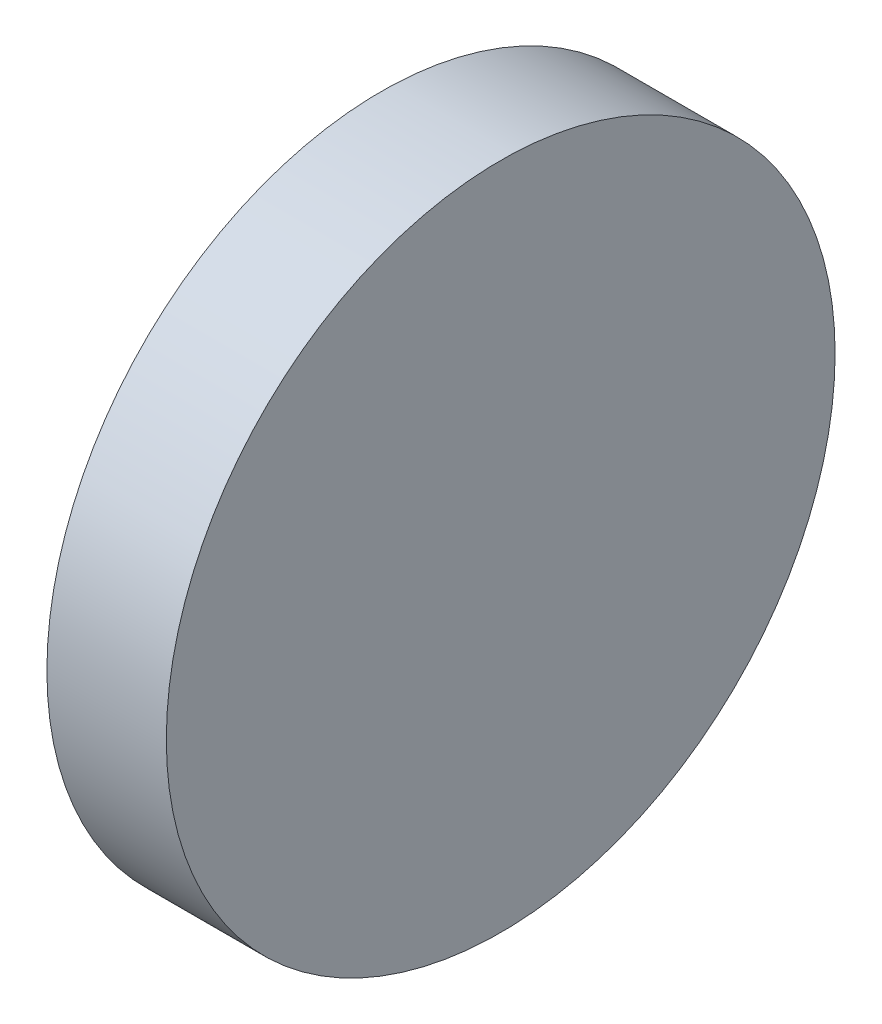
from build123d import *

# Parameters (mm, degrees)
SKETCH1_R           = 7
BOSS_EXTRUDE1_DEPTH = 2.5


with BuildPart() as part:
    # Sketch1 → Boss-Extrude1 (new body)
    with BuildSketch(Plane(origin=(0, 0, 0), x_dir=(0, 0, -1), z_dir=(1, 0, 0))):
        Circle(SKETCH1_R)
    extrude(amount=BOSS_EXTRUDE1_DEPTH)


solid = part.part
